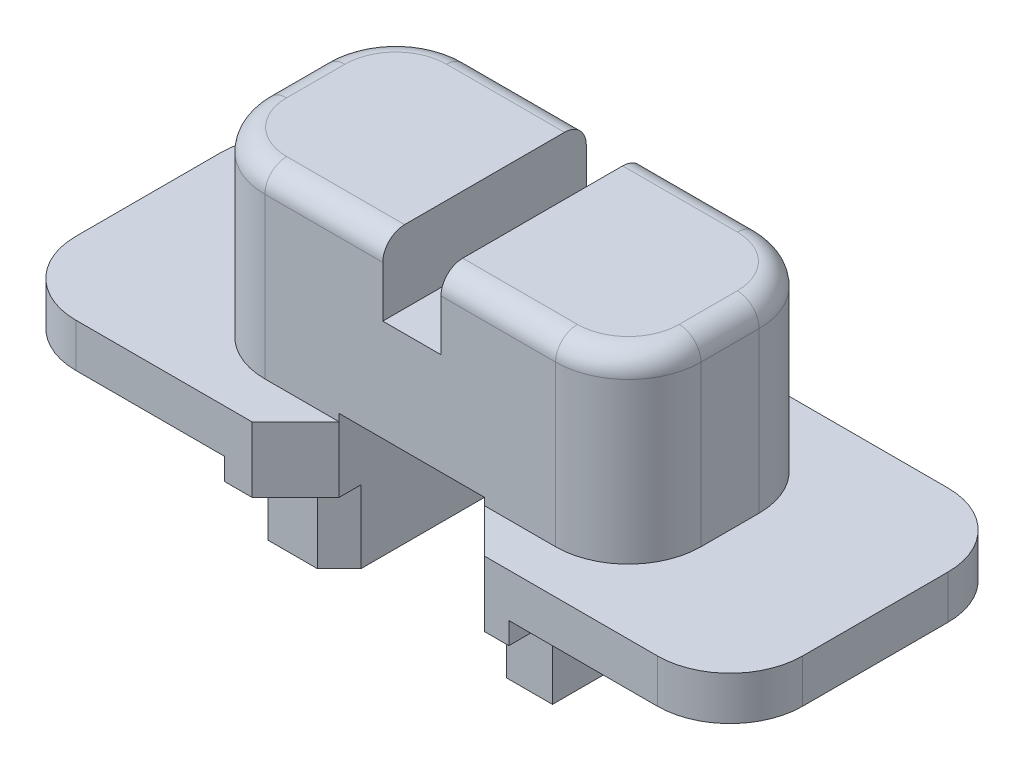
from build123d import *

# Parameters (mm, degrees)
SKETCH_1_W                      = 10
SKETCH_1_H                      = 4
EXTRUDE_1_DEPTH                 = 0.6
SKETCH_2_W                      = 6
SKETCH_2_H                      = 2.8
EXTRUDE_2_DEPTH                 = 2.5
FILLET_1_R                      = 1
CUT_EXTRUDE_2_REACH             = 9.134
SKETCH_7_W                      = 0.8
SKETCH_7_H                      = 1
CUT_EXTRUDE_2_DIRECTION_2_DEPTH = 8.134379197
SKETCH_8_W                      = 3.913502977
SKETCH_8_H                      = 4
EXTRUDE_3_DEPTH                 = 0.3
CUT_EXTRUDE_3_REACH             = 9.439
SKETCH_9_W                      = 2
SKETCH_9_H                      = 1
CHAMFER_2_SIZE                  = 0.6
FILLET_2_R                      = 0.3
SKETCH_10_W                     = 0.979037501
SKETCH_10_H                     = 2.8
SKETCH_10_W_2                   = 0.934465476
EXTRUDE_4_DEPTH                 = 1
CHAMFER_3_SIZE                  = 0.3


with BuildPart() as part:
    # 草图1 → 凸台-拉伸1 (new body)
    with BuildSketch(Plane(origin=(0, 0, 0), x_dir=(1, 0, 0), z_dir=(0, 1, 0))):
        with Locations((0.452464262, 0)):
            Rectangle(SKETCH_1_W, SKETCH_1_H)
    extrude(amount=EXTRUDE_1_DEPTH)

    # 草图2 → 凸台-拉伸2 (add)
    with BuildSketch(Plane(origin=(0, 0.6, 0), x_dir=(1, 0, 0), z_dir=(0, 1, 0))):
        with Locations((0.452464262, 0)):
            Rectangle(SKETCH_2_W, SKETCH_2_H)
    extrude(amount=EXTRUDE_2_DEPTH)

    # 圆角1
    fillet_1_edges = [part.edges().sort_by_distance(p)[0] for p in [
        (3.452464262, 1.85, 1.4),
        (3.452464262, 1.85, -1.4),
        (-2.547535738, 1.85, -1.4),
        (-2.547535738, 1.85, 1.4),
        (5.452464262, 0.3, 2),
        (-4.547535738, 0.3, 2),
        (-4.547535738, 0.3, -2),
        (5.452464262, 0.3, -2),
    ]]
    fillet(fillet_1_edges, radius=FILLET_1_R)

    # 草图7 → 切除-拉伸2 (cut, up to next)
    with BuildSketch(Plane.XY.offset(1.4), mode=Mode.PRIVATE) as cut_extrude_2_sk1:
        with Locations((0.474750274, 2.6)):
            Rectangle(SKETCH_7_W, SKETCH_7_H)
    cut_extrude_2_tool1 = extrude(cut_extrude_2_sk1.sketch, amount=-CUT_EXTRUDE_2_REACH, mode=Mode.PRIVATE) & part.part
    add(cut_extrude_2_tool1.solids().sort_by_distance((0.47475, 2.6, 1.4))[0], mode=Mode.SUBTRACT)

    # 草图7 → 切除-拉伸2 direction 2 (cut)
    with BuildSketch(Plane.XY.offset(1.4)):
        with Locations((0.474750274, 2.6)):
            Rectangle(SKETCH_7_W, SKETCH_7_H)
    extrude(amount=CUT_EXTRUDE_2_DIRECTION_2_DEPTH, mode=Mode.SUBTRACT)

    # 草图8 → 凸台-拉伸3 (add)
    with BuildSketch(Plane.XZ):
        with Locations((0.452464261, 0)):
            Rectangle(SKETCH_8_W, SKETCH_8_H)
    extrude(amount=EXTRUDE_3_DEPTH)

    # 草图9 → 切除-拉伸3 (cut, up to next)
    with BuildSketch(Plane(origin=(0, 0, -2), x_dir=(-1, 0, 0), z_dir=(0, 0, -1)), mode=Mode.PRIVATE) as cut_extrude_3_sk1:
        with Locations((-0.474750274, 0.2)):
            Rectangle(SKETCH_9_W, SKETCH_9_H)
    cut_extrude_3_tool1 = extrude(cut_extrude_3_sk1.sketch, amount=-CUT_EXTRUDE_3_REACH, mode=Mode.PRIVATE) & part.part
    add(cut_extrude_3_tool1.solids().sort_by_distance((0.47475, 0.2, -2))[0], mode=Mode.SUBTRACT)

    # 倒角2
    chamfer_2_edges = [part.edges().sort_by_distance(p)[0] for p in [
        (-0.525249726, 0.15, 2),
        (-0.525249726, 0.15, -2),
        (1.474750274, 0.15, -2),
        (1.474750274, 0.15, 2),
    ]]
    chamfer(chamfer_2_edges, length=CHAMFER_2_SIZE)

    # 圆角2
    fillet_2_edges = [part.edges().sort_by_distance(p)[0] for p in [
        (-0.736392732, 3.1, 1.4),
        (-2.547535738, 3.1, 0),
        (3.452464262, 3.1, 0),
        (1.663607268, 3.1, -1.4),
        (3.159571043, 3.1, -1.107106781),
        (-2.25464252, 3.1, -1.107106781),
        (3.159571043, 3.1, 1.107106781),
        (-2.25464252, 3.1, 1.107106781),
        (1.663607268, 3.1, 1.4),
        (-0.736392732, 3.1, -1.4),
    ]]
    fillet(fillet_2_edges, radius=FILLET_2_R)

    # 草图10 → 凸台-拉伸4 (add)
    with BuildSketch(Plane.XZ.offset(0.3)):
        with Locations((-1.014768477, 0)):
            Rectangle(SKETCH_10_W, SKETCH_10_H)
        with Locations((1.941983012, 0)):
            Rectangle(SKETCH_10_W_2, SKETCH_10_H)
    extrude(amount=EXTRUDE_4_DEPTH)

    # 倒角3
    chamfer_3_edges = [part.edges().sort_by_distance(p)[0] for p in [
        (-0.525249726, -0.8, -1.4),
        (-0.525249726, -0.8, 1.4),
        (1.474750274, -0.8, 1.4),
        (1.474750274, -0.8, -1.4),
    ]]
    chamfer(chamfer_3_edges, length=CHAMFER_3_SIZE)


solid = part.part
